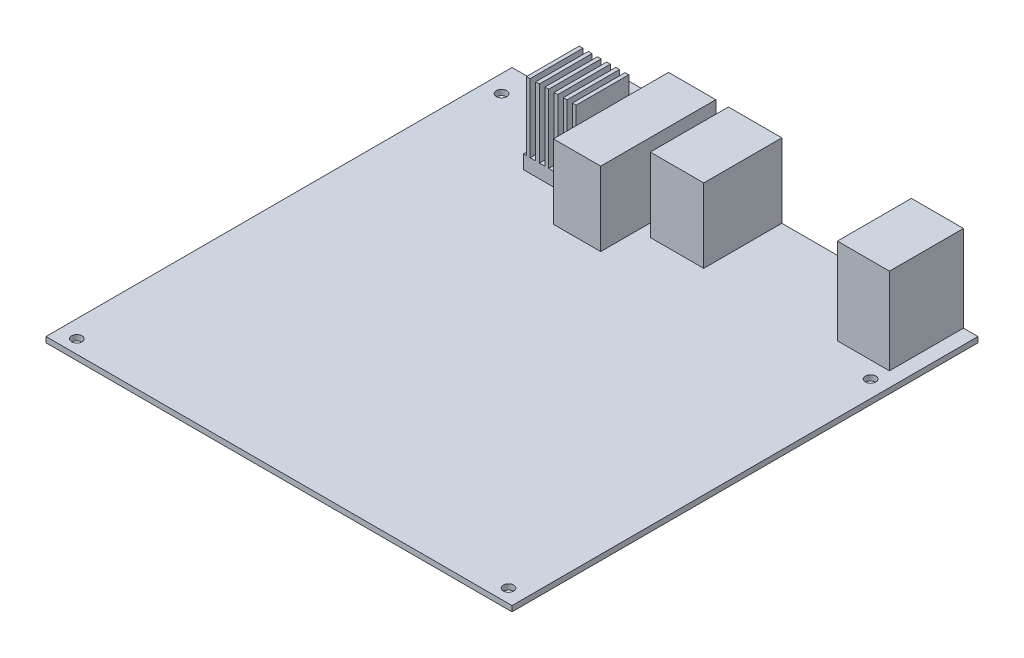
from build123d import *

# Parameters (mm, degrees)
SKETCH1_W                = 170
SKETCH1_H                = 170
BOSS_EXTRUDE1_DEPTH      = 2
F_6_CLEARANCE_HOLE1_D    = 3.7973
SKETCH5_W                = 19
SKETCH5_H                = 27
BOSS_EXTRUDE2_DEPTH      = 31.5
SKETCH6_W                = 19.5
SKETCH6_H                = 28.5
SKETCH6_W_2              = 17.25
SKETCH6_H_2              = 42
BOSS_EXTRUDE3_DEPTH      = 27
SKETCH7_W                = 19.2
SKETCH7_H                = 19.2
BOSS_EXTRUDE4_DEPTH      = 30
SKETCH8_W                = 2
SKETCH8_H                = 25
SKETCH8_W_2              = 1.1
CUT_EXTRUDE1_DEPTH       = 184.3800698
BOSS_EXTRUDE5_DEPTH      = 6
BOSS_EXTRUDE5_DEPTH_BACK = 4.2
SKETCH9_W                = 31
SKETCH9_H                = 11


with BuildPart() as part:
    # Sketch1 → Boss-Extrude1 (new body)
    with BuildSketch(Plane(origin=(0, 0, 0), x_dir=(1, 0, 0), z_dir=(0, 1, 0))):
        Rectangle(SKETCH1_W, SKETCH1_H)
    extrude(amount=BOSS_EXTRUDE1_DEPTH)

    # #6 Clearance Hole1 (through all)
    with Locations(Plane(origin=(-78.65, 2, -74.84), x_dir=(0, 0, 1), z_dir=(0, 1, 0))):
        with Locations((0, 0), (154.94, 0), (154.94, 157.48), (22.86, 157.48)):
            Hole(F_6_CLEARANCE_HOLE1_D / 2)

    # Sketch5 → Boss-Extrude2 (add)
    with BuildSketch(Plane(origin=(0, 2, 0), x_dir=(1, 0, 0), z_dir=(0, 1, 0))):
        with Locations((70.2, 71.5)):
            Rectangle(SKETCH5_W, SKETCH5_H)
    extrude(amount=BOSS_EXTRUDE2_DEPTH)

    # Sketch6 → Boss-Extrude3 (add)
    with BuildSketch(Plane(origin=(0, 2, 0), x_dir=(1, 0, 0), z_dir=(0, 1, 0))):
        with Locations((3.7, 70.75)):
            Rectangle(SKETCH6_W, SKETCH6_H)
        with Locations((-19.275, 64)):
            Rectangle(SKETCH6_W_2, SKETCH6_H_2)
    extrude(amount=BOSS_EXTRUDE3_DEPTH)

    # Sketch7 → Boss-Extrude4 (add)
    with BuildSketch(Plane(origin=(0, 2, 0), x_dir=(1, 0, 0), z_dir=(0, 1, 0))):
        with Locations((-41, 64.4)):
            Rectangle(SKETCH7_W, SKETCH7_H)
    extrude(amount=BOSS_EXTRUDE4_DEPTH)

    # Sketch8 → Cut-Extrude1 (cut, through all)
    with BuildSketch(Plane(origin=(0, 0, -74), x_dir=(-1, 0, 0), z_dir=(0, 0, -1))):
        with Locations((33.75, 19.5)):
            Rectangle(SKETCH8_W, SKETCH8_H)
        with Locations((37.1, 19.5)):
            Rectangle(SKETCH8_W, SKETCH8_H)
        with Locations((50.05, 19.5)):
            Rectangle(SKETCH8_W_2, SKETCH8_H)
        with Locations((40.45, 19.5)):
            Rectangle(SKETCH8_W, SKETCH8_H)
        with Locations((47.15, 19.5)):
            Rectangle(SKETCH8_W, SKETCH8_H)
        with Locations((43.8, 19.5)):
            Rectangle(SKETCH8_W, SKETCH8_H)
    extrude(amount=-CUT_EXTRUDE1_DEPTH, mode=Mode.SUBTRACT)

    # Sketch9 → Boss-Extrude5 (add, two sides: drawn at the far end of the back side and taken through both)
    with BuildSketch(Plane(origin=(0, 0, -85), x_dir=(-1, 0, 0), z_dir=(0, 0, -1)).offset(-BOSS_EXTRUDE5_DEPTH_BACK)):
        with Locations((47.9, 7.5)):
            Rectangle(SKETCH9_W, SKETCH9_H)
    extrude(amount=BOSS_EXTRUDE5_DEPTH + BOSS_EXTRUDE5_DEPTH_BACK)


solid = part.part
